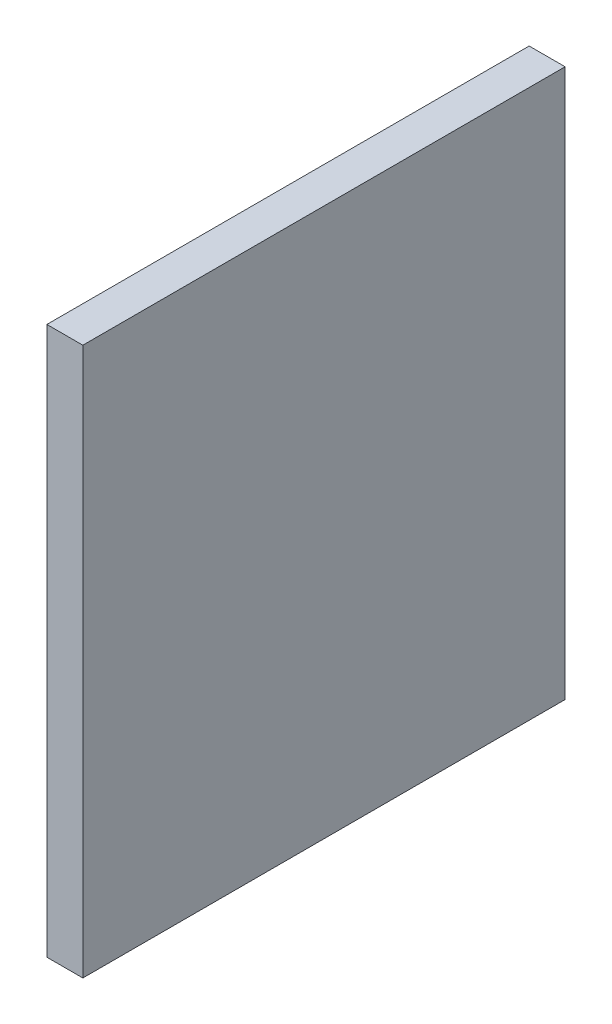
from build123d import *

# Parameters (mm, degrees)
SKETCH1_W           = 67.056
SKETCH1_H           = 76.2
BOSS_EXTRUDE1_DEPTH = 5


with BuildPart() as part:
    # Sketch1 → Boss-Extrude1 (new body)
    with BuildSketch(Plane(origin=(0, 0, 0), x_dir=(0, 0, -1), z_dir=(1, 0, 0))):
        with Locations((22.552691358, 0.094074074)):
            Rectangle(SKETCH1_W, SKETCH1_H)
    extrude(amount=BOSS_EXTRUDE1_DEPTH)


solid = part.part
